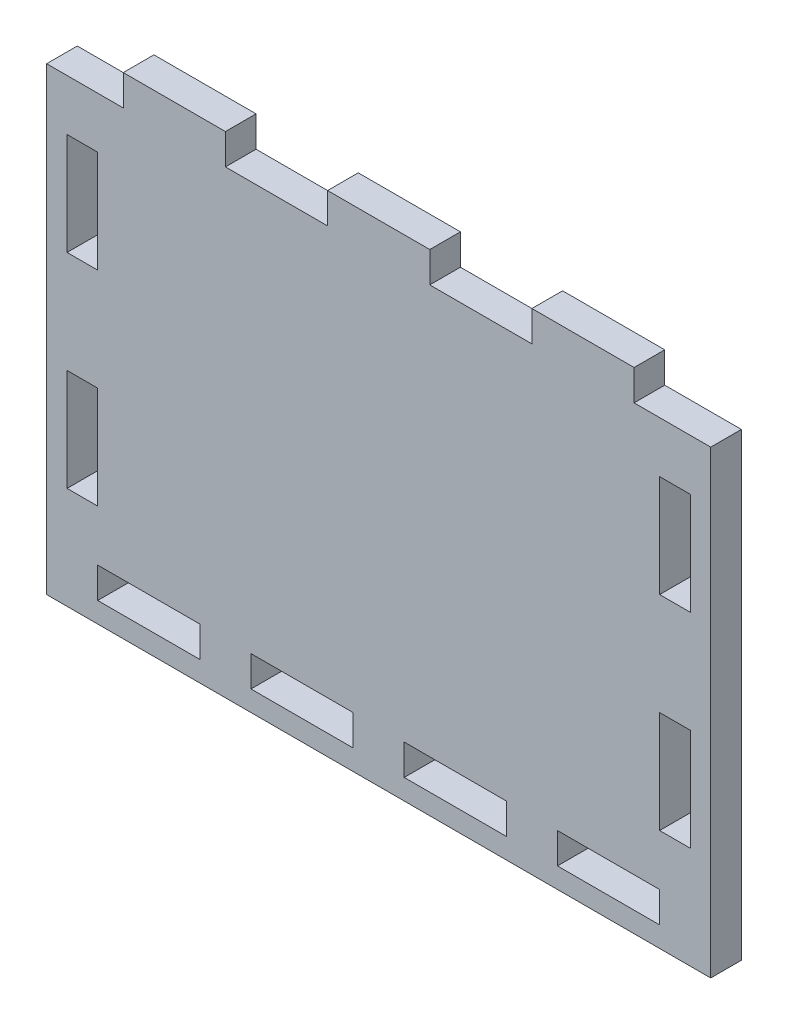
from build123d import *

# Parameters (mm, degrees)
SKETCH_1_W      = 10
SKETCH_1_H      = 3
SKETCH_1_W_2    = 3
SKETCH_1_H_2    = 10
EXTRUDE_1_DEPTH = 3


with BuildPart() as part:
    # 草图1 → 凸台-拉伸1 (new body)
    with BuildSketch(Plane.XY):
        Polygon((-4.901841459, 22.085987353), (-4.901841459, 25.085987353), (5.098158541, 25.085987353), (5.098158541, 22.085987353), (15.098158541, 22.085987353), (15.098158541, 25.085987353), (25.098158541, 25.085987353), (25.098158541, 22.085987353), (32.598158541, 22.085987353), (32.598158541, -22.914012647), (-32.401841459, -22.914012647), (-32.401841459, 22.085987353), (-24.901841459, 22.085987353), (-24.901841459, 25.085987353), (-14.901841459, 25.085987353), (-14.901841459, 22.085987353), align=None)
        with Locations((-7.401841459, -19.414012647)):
            Rectangle(SKETCH_1_W, SKETCH_1_H, mode=Mode.SUBTRACT)
        with Locations((-22.401841459, -19.414012647)):
            Rectangle(SKETCH_1_W, SKETCH_1_H, mode=Mode.SUBTRACT)
        with Locations((7.598158541, -19.414012647)):
            Rectangle(SKETCH_1_W, SKETCH_1_H, mode=Mode.SUBTRACT)
        with Locations((22.598158541, -19.414012647)):
            Rectangle(SKETCH_1_W, SKETCH_1_H, mode=Mode.SUBTRACT)
        with Locations((-28.901841459, -7.914012647)):
            Rectangle(SKETCH_1_W_2, SKETCH_1_H_2, mode=Mode.SUBTRACT)
        with Locations((-28.901841459, 12.085987353)):
            Rectangle(SKETCH_1_W_2, SKETCH_1_H_2, mode=Mode.SUBTRACT)
        with Locations((29.098158541, -7.914012647)):
            Rectangle(SKETCH_1_W_2, SKETCH_1_H_2, mode=Mode.SUBTRACT)
        with Locations((29.098158541, 12.085987353)):
            Rectangle(SKETCH_1_W_2, SKETCH_1_H_2, mode=Mode.SUBTRACT)
    extrude(amount=EXTRUDE_1_DEPTH)


solid = part.part
